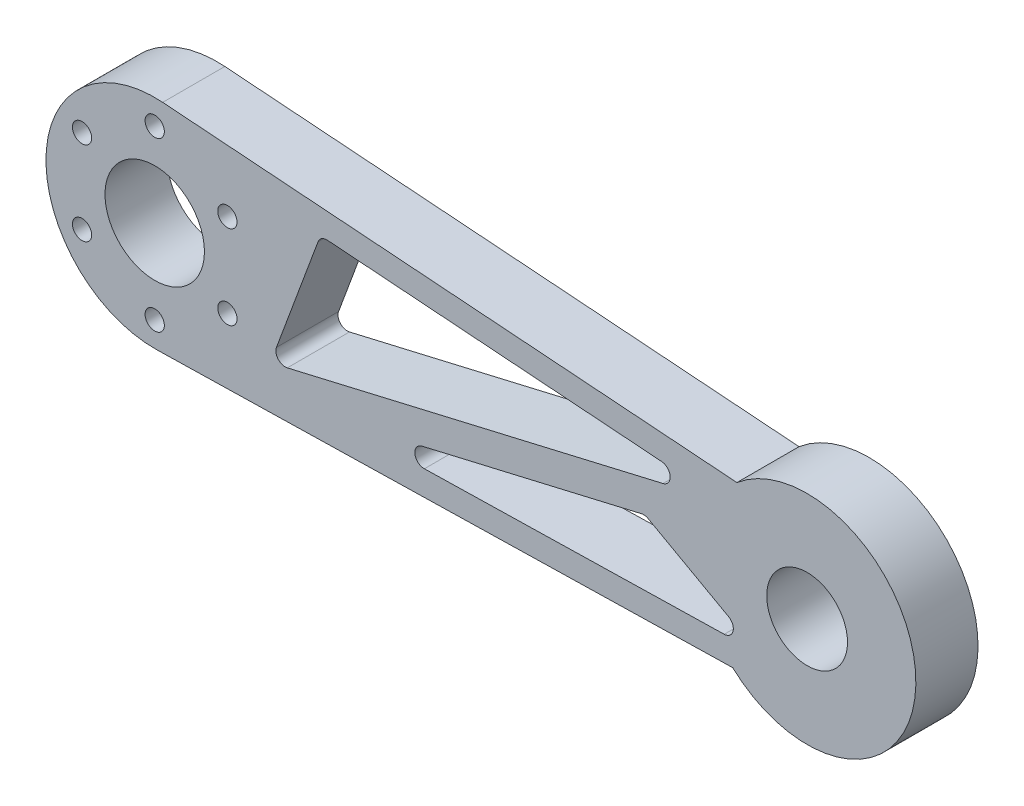
from build123d import *

# Parameters (mm, degrees)
EXTRUDE_1_DEPTH     = 10
SKETCH_2_R          = 1.55
SKETCH_2_R_2        = 8
CUT_EXTRUDE_1_DEPTH = 10
CUT_EXTRUDE_2_DEPTH = 25
FILLET_1_R          = 1.5
SKETCH_4_R          = 6.5
CUT_EXTRUDE_3_DEPTH = 25
EXTRUDE_START       = -10
EXTRUDE_2_DEPTH     = 10


with BuildPart() as part:
    # 草图1 → 凸台-拉伸1 (new body)
    with BuildSketch(Plane.XY):
        with BuildLine():
            Line((105.880667011, 9.774167654), (1.281264399, 17.453033018))
            ThreePointArc((1.281264399, 17.453033018), (-17.494246359, 0.448714084), (0.384854302, -17.495767693))
            Line((0.384854302, -17.495767693), (105.240374084, -15.189261425))
            ThreePointArc((105.240374084, -15.189261425), (117.461368411, -3.012794561), (105.880667011, 9.774167654))
        make_face()
    extrude(amount=EXTRUDE_1_DEPTH)

    # 草图2 → 切除-拉伸1 (cut)
    with BuildSketch(Plane.XY.offset(10)):
        with Locations((0, 13.5)):
            Circle(SKETCH_2_R)
        with Locations((11.691342951, 6.75)):
            Circle(SKETCH_2_R)
        with Locations((11.691342951, -6.75)):
            Circle(SKETCH_2_R)
        with Locations((0, -13.5)):
            Circle(SKETCH_2_R)
        with Locations((-11.691342951, -6.75)):
            Circle(SKETCH_2_R)
        with Locations((-11.691342951, 6.75)):
            Circle(SKETCH_2_R)
        Circle(SKETCH_2_R_2)
    extrude(amount=-CUT_EXTRUDE_1_DEPTH, mode=Mode.SUBTRACT)

    # 草图3 → 切除-拉伸2 (cut)
    with BuildSketch(Plane.XY.offset(10)):
        Polygon((28.969702276, -12.866019337), (97.16669186, -11.365890548), (78.883612283, -1.217324734), align=None)
        Polygon((26.667415907, 11.578617262), (18.617416428, -10.147636057), (91.362216416, 6.829233896), align=None)
    extrude(amount=-CUT_EXTRUDE_2_DEPTH, mode=Mode.SUBTRACT)

    # 圆角1
    fillet_1_edges = [part.edges().sort_by_distance(p)[0] for p in [
        (26.667415907, 11.578617262, 5),
        (91.362216416, 6.829233896, 5),
        (18.617416428, -10.147636057, 5),
        (28.969702276, -12.866019337, 5),
        (78.883612283, -1.217324734, 5),
        (97.16669186, -11.365890548, 5),
    ]]
    fillet(fillet_1_edges, radius=FILLET_1_R)

    # 草图4 → 切除-拉伸3 (cut)
    with BuildSketch(Plane.XY.offset(10)):
        with Locations((104.965478154, -2.692284502)):
            Circle(SKETCH_4_R)
    extrude(amount=-CUT_EXTRUDE_3_DEPTH, mode=Mode.SUBTRACT)

    # 草图5 → 凸台-拉伸2 (add)
    with BuildSketch(Plane.XY.offset(10).offset(EXTRUDE_START)):
        with BuildLine():
            Line((93.666088337, 10.670865941), (105.880667011, 9.774167654))
            ThreePointArc((105.880667011, 9.774167654), (117.461368411, -3.012794561), (105.240374084, -15.189261425))
            Line((105.240374084, -15.189261425), (92.995887368, -15.458603329))
            ThreePointArc((92.995887368, -15.458603329), (122.459724513, -3.140998585), (93.666088337, 10.670865941))
        make_face()
    extrude(amount=EXTRUDE_2_DEPTH)


solid = part.part
